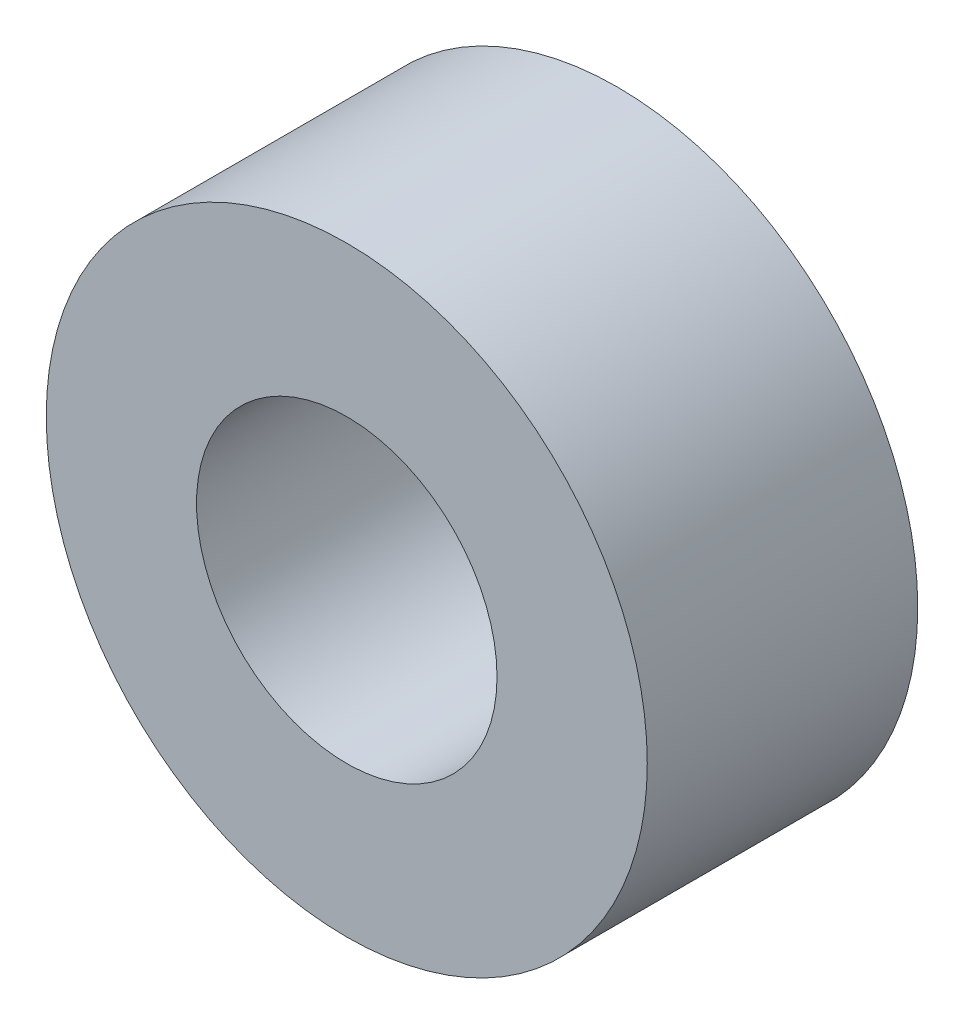
from build123d import *

# Parameters (mm, degrees)
SKETCH1_R           = 12.7
BOSS_EXTRUDE1_DEPTH = 11.43
SKETCH2_R           = 6.35
CUT_EXTRUDE1_DEPTH  = 22.28907936


with BuildPart() as part:
    # Sketch1 → Boss-Extrude1 (new body)
    with BuildSketch(Plane.XY):
        Circle(SKETCH1_R)
    extrude(amount=BOSS_EXTRUDE1_DEPTH)

    # Sketch2 → Cut-Extrude1 (cut, through all)
    with BuildSketch(Plane.XY.offset(11.43)):
        Circle(SKETCH2_R)
    extrude(amount=-CUT_EXTRUDE1_DEPTH, mode=Mode.SUBTRACT)


solid = part.part
